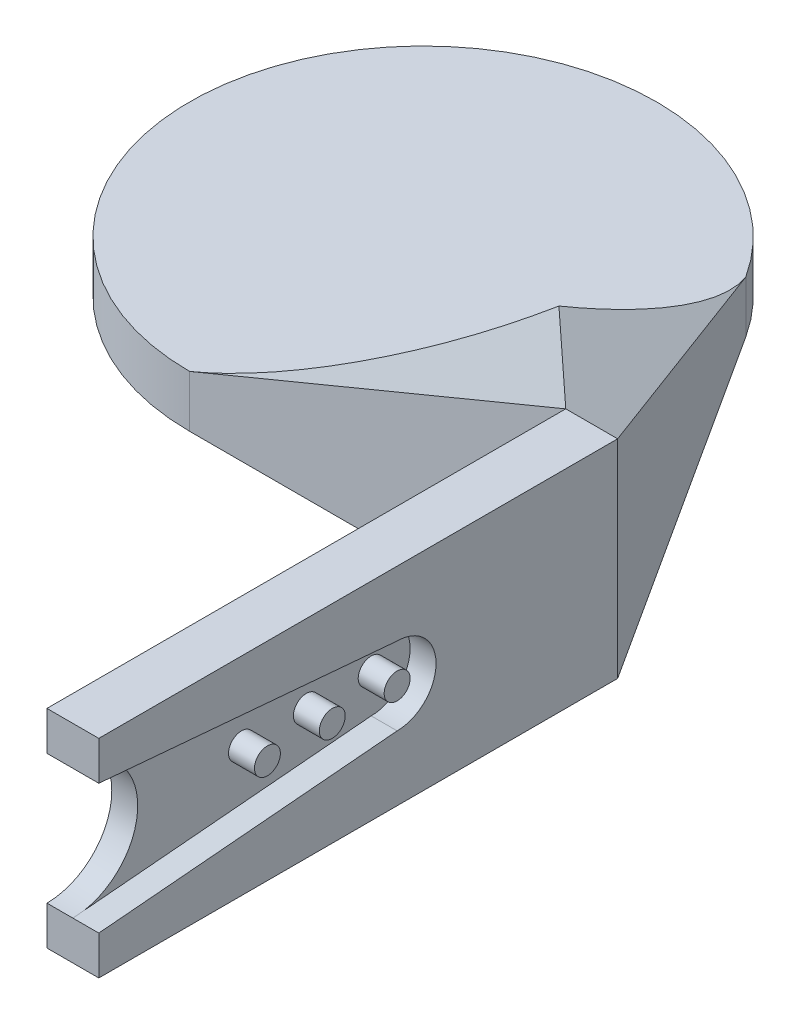
from build123d import *

# Parameters (mm, degrees)
SKETCH1_R           = 9
BOSS_EXTRUDE1_DEPTH = 2
BOSS_EXTRUDE2_DEPTH = 8
SKETCH1_5_R         = 0.5
CUT_EXTRUDE1_DEPTH  = 1
CUT_EXTRUDE2_DEPTH  = 9
SKETCH4_R           = 0.5
CUT_EXTRUDE5_DEPTH  = 1
SKETCH6_R           = 2.5
CUT_EXTRUDE6_DEPTH  = 10
CUT_EXTRUDE8_DEPTH  = 10


with BuildPart() as part:
    # Sketch1 → Boss-Extrude1 (new body)
    with BuildSketch(Plane(origin=(0, 0, 0), x_dir=(1, 0, 0), z_dir=(0, 1, 0))):
        Circle(SKETCH1_R)
    extrude(amount=BOSS_EXTRUDE1_DEPTH)

    # Sketch1<4> → Boss-Extrude2 (add)
    with BuildSketch(Plane(origin=(0, 0, 0), x_dir=(1, 0, 0), z_dir=(0, 1, 0))):
        with BuildLine():
            Line((0, -9), (14.5, -9))
            Line((14.5, -9), (14.5, -29))
            Line((14.5, -29), (16.5, -29))
            Line((16.5, -29), (16.5, -9))
            Line((16.5, -9), (7.566878981, 4.872611465))
            ThreePointArc((7.566878981, 4.872611465), (7.901060156, -4.309669176), (0, -9))
        make_face()
    extrude(amount=BOSS_EXTRUDE2_DEPTH)

    # Sketch1<5> → Cut-Extrude1 (cut)
    with BuildSketch(Plane(origin=(0, 0, 0), x_dir=(1, 0, 0), z_dir=(0, 1, 0))):
        with BuildLine():
            ThreePointArc((1.5, -2), (1.767766953, -1.767766953), (2, -1.5))
            Line((2, -1.5), (6.5, -1.5))
            ThreePointArc((6.5, -1.5), (8, 0), (6.5, 1.5))
            Line((6.5, 1.5), (2, 1.5))
            ThreePointArc((2, 1.5), (1.767766953, 1.767766953), (1.5, 2))
            Line((1.5, 2), (1.5, 6.5))
            ThreePointArc((1.5, 6.5), (0, 8), (-1.5, 6.5))
            Line((-1.5, 6.5), (-1.5, 2))
            ThreePointArc((-1.5, 2), (-1.767766953, 1.767766953), (-2, 1.5))
            Line((-2, 1.5), (-6.5, 1.5))
            ThreePointArc((-6.5, 1.5), (-8, 0), (-6.5, -1.5))
            Line((-6.5, -1.5), (-2, -1.5))
            ThreePointArc((-2, -1.5), (-1.767766953, -1.767766953), (-1.5, -2))
            Line((-1.5, -2), (-1.5, -6.5))
            ThreePointArc((-1.5, -6.5), (0, -8), (1.5, -6.5))
            Line((1.5, -6.5), (1.5, -2))
        make_face()
        with Locations((6.5, 0)):
            Circle(SKETCH1_5_R, mode=Mode.SUBTRACT)
        with Locations((0, -6.5)):
            Circle(SKETCH1_5_R, mode=Mode.SUBTRACT)
        with Locations((-6.5, 0)):
            Circle(SKETCH1_5_R, mode=Mode.SUBTRACT)
        with Locations((0, 6.5)):
            Circle(SKETCH1_5_R, mode=Mode.SUBTRACT)
    extrude(amount=CUT_EXTRUDE1_DEPTH, mode=Mode.SUBTRACT)

    # Sketch2 → Cut-Extrude2 (cut)
    with BuildSketch(Plane.XY.offset(9)):
        Polygon((0, 2), (14.5, 8), (0, 8), align=None)
    extrude(amount=-CUT_EXTRUDE2_DEPTH, mode=Mode.SUBTRACT)

    # Sketch4 → Cut-Extrude5 (cut)
    with BuildSketch(Plane(origin=(16.5, 0, 0), x_dir=(0, 0, -1), z_dir=(1, 0, 0))):
        with BuildLine():
            Line((-29, 6.5), (-29, 1.5))
            Line((-29, 1.5), (-17.5, 2.5))
            ThreePointArc((-17.5, 2.5), (-16, 4), (-17.5, 5.5))
            Line((-17.5, 5.5), (-29, 6.5))
        make_face()
        with Locations((-22.5, 4)):
            Circle(SKETCH4_R, mode=Mode.SUBTRACT)
        with Locations((-20, 4)):
            Circle(SKETCH4_R, mode=Mode.SUBTRACT)
        with Locations((-17.5, 4)):
            Circle(SKETCH4_R, mode=Mode.SUBTRACT)
    extrude(amount=-CUT_EXTRUDE5_DEPTH, mode=Mode.SUBTRACT)

    # Sketch6 → Cut-Extrude6 (cut)
    with BuildSketch(Plane(origin=(15.5, 0, 0), x_dir=(0, 0, -1), z_dir=(1, 0, 0))):
        with Locations((-29, 4)):
            Circle(SKETCH6_R)
    extrude(amount=-CUT_EXTRUDE6_DEPTH, mode=Mode.SUBTRACT)

    # Sketch8 → Cut-Extrude8 (cut)
    with BuildSketch(Plane(origin=(16.5, 0, 0), x_dir=(0, 0, -1), z_dir=(1, 0, 0))):
        Polygon((-9, 8), (4.872611465, 2), (4.872611465, 8), align=None)
    extrude(amount=-CUT_EXTRUDE8_DEPTH, mode=Mode.SUBTRACT)


solid = part.part
